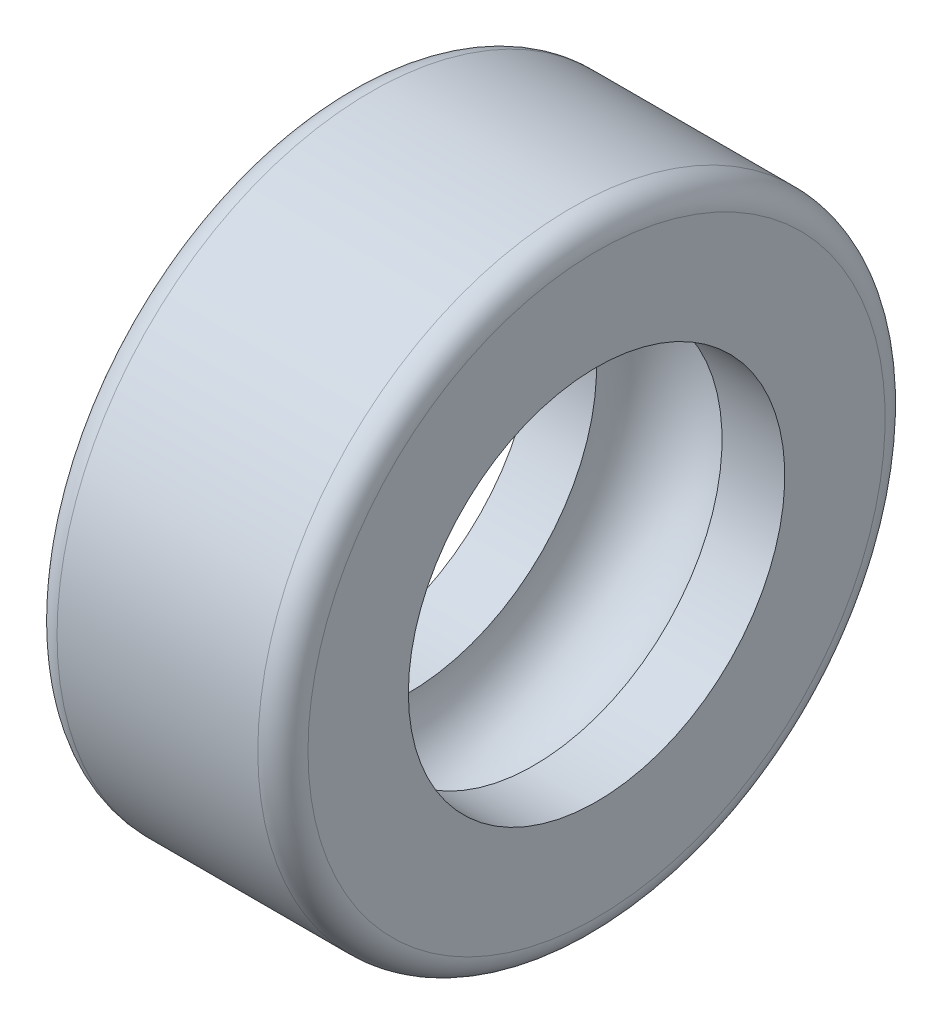
from build123d import *

# Parameters (mm, degrees)
FILLET1_R = 1


with BuildPart() as part:
    # Sketch1 → Revolve1 (revolve)
    with BuildSketch(Plane.XY, mode=Mode.PRIVATE) as revolve1_sk:
        with BuildLine():
            Line((2.5, 7.5), (5, 7.5))
            Line((5, 7.5), (5, 12.5))
            Line((5, 12.5), (-5, 12.5))
            Line((-5, 12.5), (-5, 7.5))
            Line((-5, 7.5), (-2.5, 7.5))
            ThreePointArc((-2.5, 7.5), (0, 10), (2.5, 7.5))
        make_face()
    revolve(revolve1_sk.sketch.rotate(Axis((0, 0, 0), (1, 0, 0)), 90), axis=Axis((0, 0, 0), (1, 0, 0)))

    # Fillet1
    fillet1_edges = [part.edges().sort_by_distance(p)[0] for p in [
        (-5, 0, -12.5),
        (5, 0, -12.5),
    ]]
    fillet(fillet1_edges, radius=FILLET1_R)


solid = part.part
